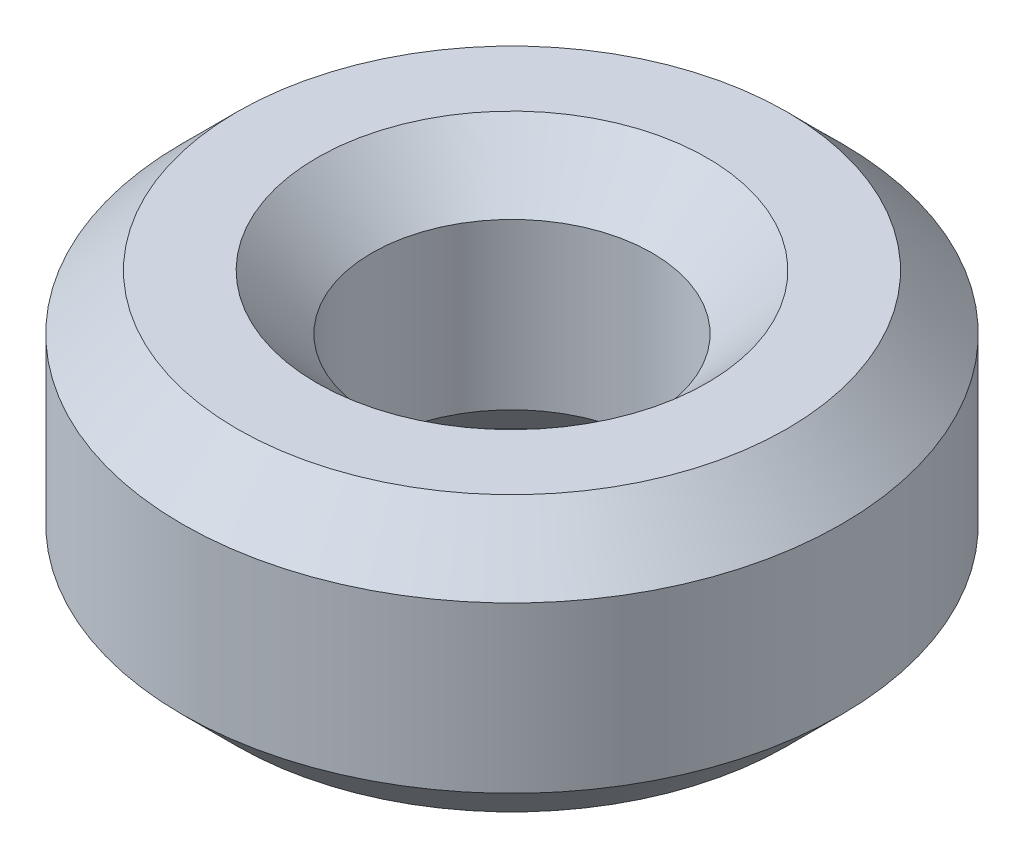
from build123d import *

# Parameters (mm, degrees)
SKETCH1_R           = 6
SKETCH1_R_2         = 2.55
BOSS_EXTRUDE1_DEPTH = 5
CHAMFER1_SIZE       = 1


with BuildPart() as part:
    # Sketch1 → Boss-Extrude1 (new body)
    with BuildSketch(Plane(origin=(0, 0, 0), x_dir=(1, 0, 0), z_dir=(0, 1, 0))):
        with Locations(Location((0, 0, 0), (0, 0, 270))):
            Circle(SKETCH1_R)
        with Locations(Location((0, 0, 0), (0, 0, 270))):
            Circle(SKETCH1_R_2, mode=Mode.SUBTRACT)
    extrude(amount=BOSS_EXTRUDE1_DEPTH)

    # Chamfer1
    chamfer1_edges = [part.edges().sort_by_distance(p)[0] for p in [
        (0, 5, -6),
        (0, 0, -6),
        (0, 0, -2.55),
        (0, 5, -2.55),
    ]]
    chamfer(chamfer1_edges, length=CHAMFER1_SIZE)


solid = part.part
